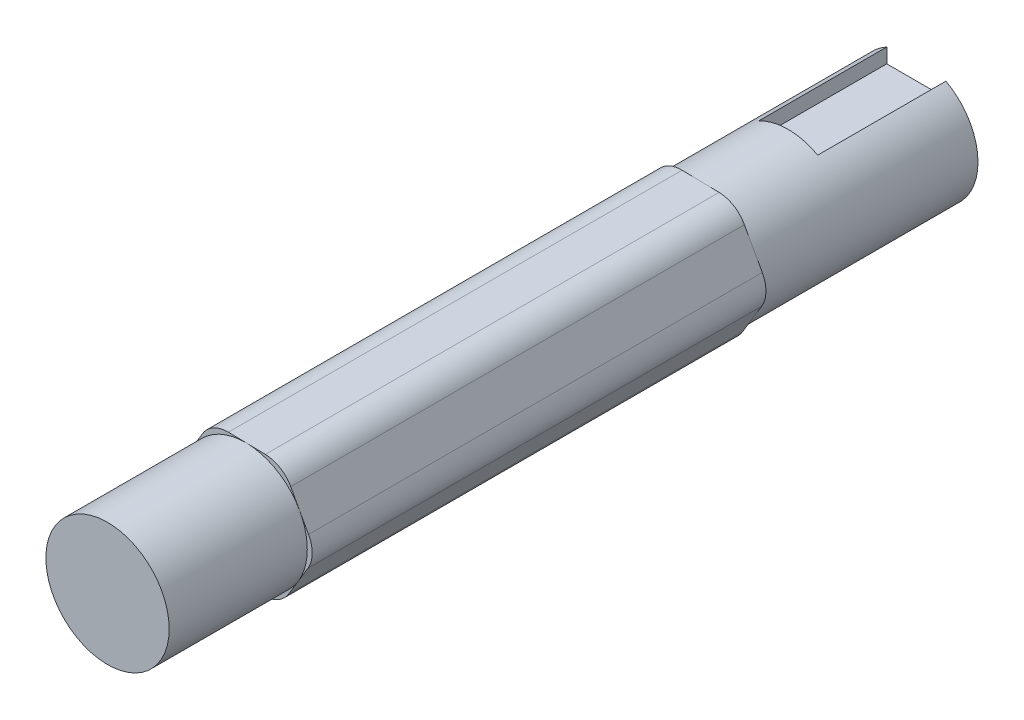
from build123d import *

# Parameters (mm, degrees)
BOSS_EXTRUDE1_DEPTH      = 37
BOSS_EXTRUDE1_DEPTH_BACK = 45
SKETCH1_R                = 6.25
SKETCH4_W                = 6
SKETCH4_H                = 4.5
CUT_EXTRUDE1_DEPTH       = 13
BOSS_EXTRUDE2_DEPTH      = 46
FILLET1_R                = 3


with BuildPart() as part:
    # Sketch1 → Boss-Extrude1 (new, two sides: drawn at the far end of the back side and taken through both)
    with BuildSketch(Plane.XY.offset(-BOSS_EXTRUDE1_DEPTH_BACK)):
        Circle(SKETCH1_R)
    extrude(amount=BOSS_EXTRUDE1_DEPTH + BOSS_EXTRUDE1_DEPTH_BACK)

    # Sketch4 → Cut-Extrude1 (cut)
    with BuildSketch(Plane(origin=(0, 0, -45), x_dir=(-1, 0, 0), z_dir=(0, 0, -1))):
        with Locations((0, 6.25)):
            Rectangle(SKETCH4_W, SKETCH4_H)
    extrude(amount=-CUT_EXTRUDE1_DEPTH, mode=Mode.SUBTRACT)

    # Sketch5 → Boss-Extrude2 (add)
    with BuildSketch(Plane.XY.offset(-23)):
        Polygon((3.732897661, 6.176472163), (-3.482532969, 6.321020286), (-7.21543063, 0.144548123), (-3.732897661, -6.176472163), (3.482532969, -6.321020286), (7.21543063, -0.144548123), align=None)
    extrude(amount=BOSS_EXTRUDE2_DEPTH)

    # Fillet1
    fillet1_edges = [part.edges().sort_by_distance(p)[0] for p in [
        (7.21543063, -0.144548123, 0),
        (3.732897661, 6.176472163, 0),
        (-3.482532969, 6.321020286, 0),
        (-7.21543063, 0.144548123, 0),
        (-3.732897661, -6.176472163, 0),
        (3.482532969, -6.321020286, 0),
    ]]
    fillet(fillet1_edges, radius=FILLET1_R)


solid = part.part
